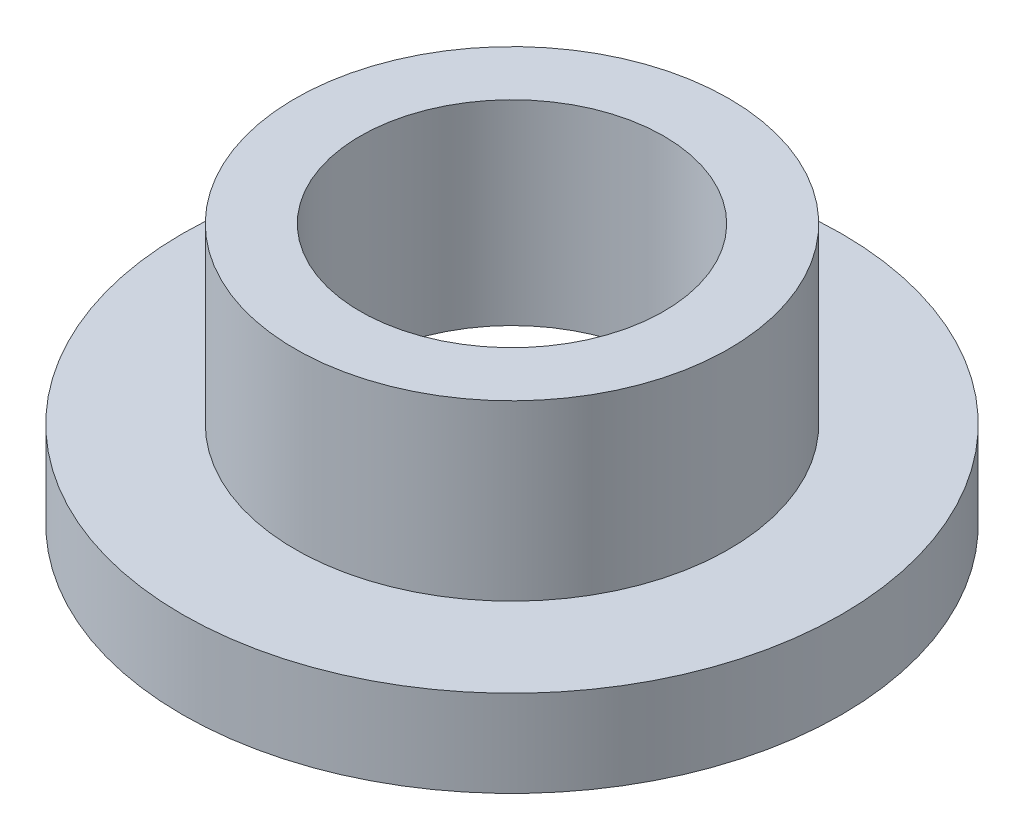
from build123d import *


with BuildPart() as part:
    # Sketch1 → Revolve1 (revolve)
    with BuildSketch(Plane.XY, mode=Mode.PRIVATE) as revolve1_sk:
        Polygon((17.5, 30), (17.5, 7.461389802), (38, 0), (38, 10), (25, 10), (25, 30), align=None)
    revolve(revolve1_sk.sketch.rotate(Axis((0, 0, 0), (0, 1, 0)), 90), axis=Axis((0, 0, 0), (0, 1, 0)))


solid = part.part
